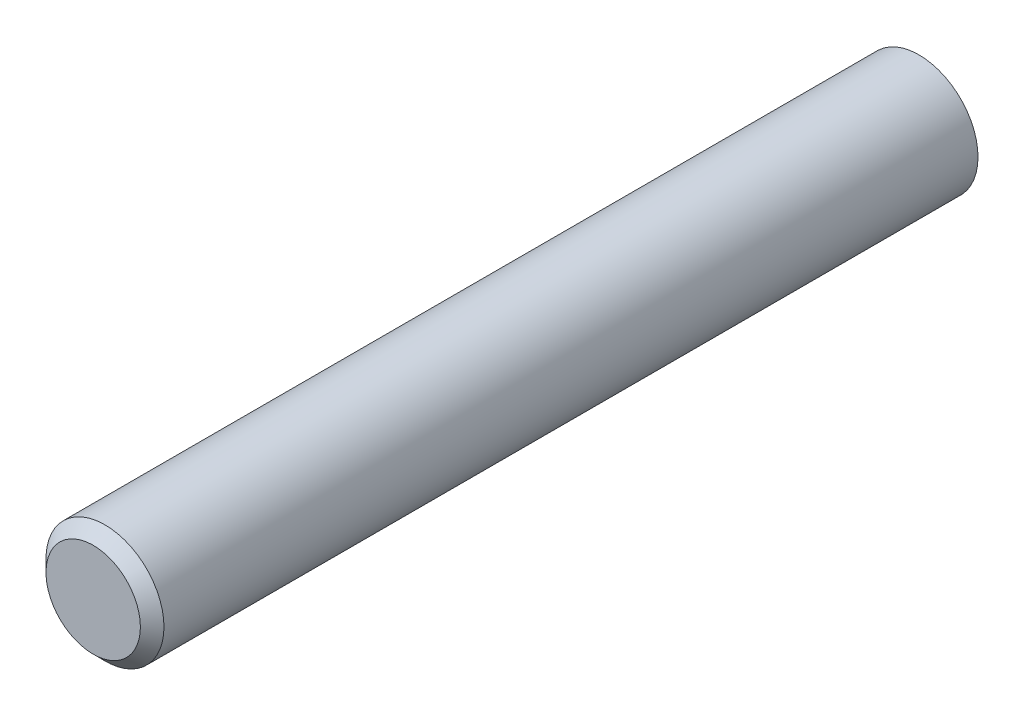
from build123d import *

# Parameters (mm, degrees)
ESQUISSE1_R        = 5
BOSS_EXTRU_1_DEPTH = 70
CHANFREIN2_SIZE    = 1


with BuildPart() as part:
    # Esquisse1 → Boss.-Extru.1 (new body)
    with BuildSketch(Plane.XY):
        Circle(ESQUISSE1_R)
    extrude(amount=BOSS_EXTRU_1_DEPTH)

    # Chanfrein2
    chanfrein2_edges = [part.edges().sort_by_distance(p)[0] for p in [
        (-5, 0, 70),
    ]]
    chamfer(chanfrein2_edges, length=CHANFREIN2_SIZE)


solid = part.part
